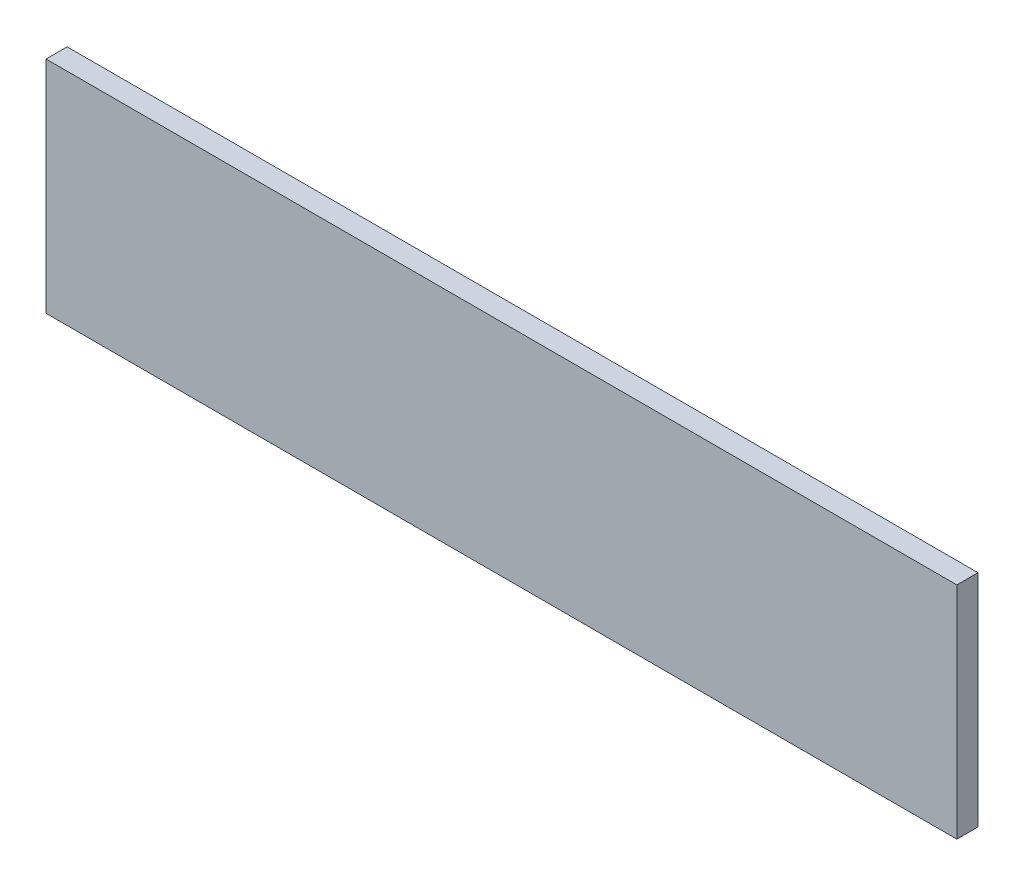
from build123d import *

# Parameters (mm, degrees)
ESQUISSE1_W        = 819
ESQUISSE1_H        = 198
BOSS_EXTRU_1_DEPTH = 19


with BuildPart() as part:
    # Esquisse1 → Boss.-Extru.1 (new body)
    with BuildSketch(Plane.XY):
        with Locations((409.5, 99)):
            Rectangle(ESQUISSE1_W, ESQUISSE1_H)
    extrude(amount=BOSS_EXTRU_1_DEPTH)


solid = part.part
